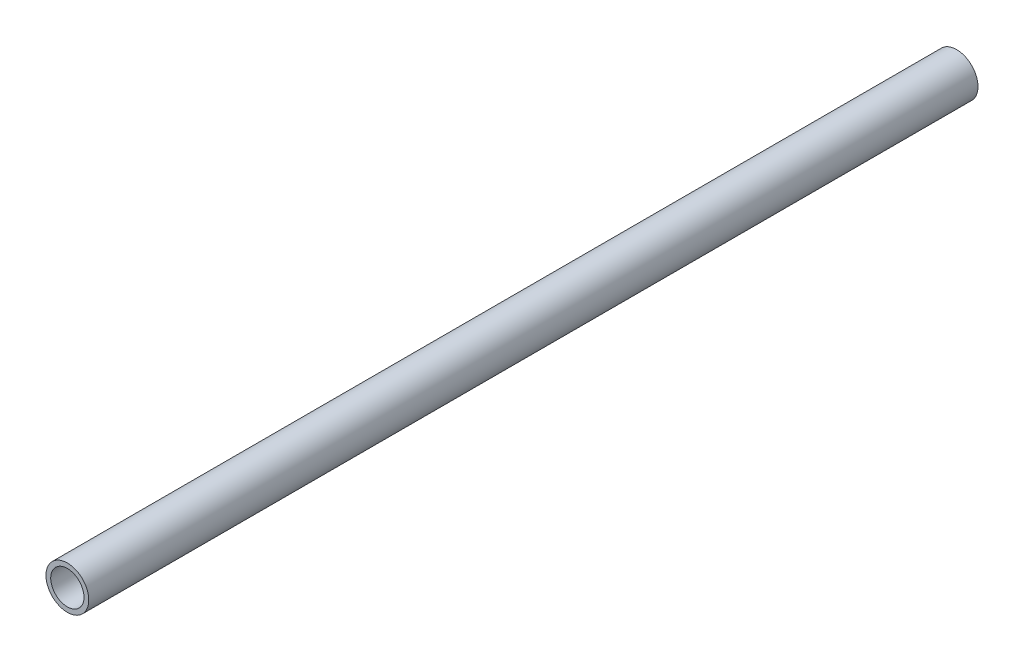
from build123d import *

# Parameters (mm, degrees)
SKETCH_1_R      = 9
SKETCH_1_R_2    = 7
EXTRUDE_1_DEPTH = 373.98


with BuildPart() as part:
    # 草图1 → 凸台-拉伸1 (new body)
    with BuildSketch(Plane.XY):
        Circle(SKETCH_1_R)
        Circle(SKETCH_1_R_2, mode=Mode.SUBTRACT)
    extrude(amount=EXTRUDE_1_DEPTH)


solid = part.part
